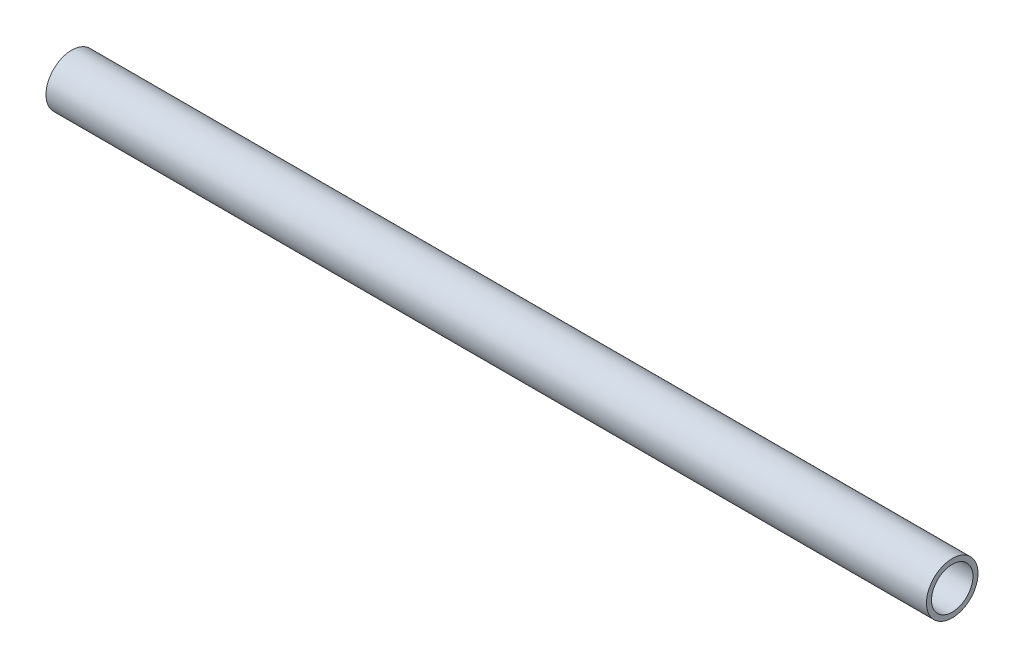
from build123d import *

# Parameters (mm, degrees)
SKIZZE1_R                       = 2.55
SKIZZE1_R_2                     = 2.05
AUFSATZ_LINEAR_AUSTRAGEN1_DEPTH = 87.15


with BuildPart() as part:
    # Skizze1 → Aufsatz-Linear austragen1 (new body)
    with BuildSketch(Plane(origin=(0, 0, 0), x_dir=(0, 0, -1), z_dir=(1, 0, 0))):
        Circle(SKIZZE1_R)
        Circle(SKIZZE1_R_2, mode=Mode.SUBTRACT)
    extrude(amount=AUFSATZ_LINEAR_AUSTRAGEN1_DEPTH)


solid = part.part
